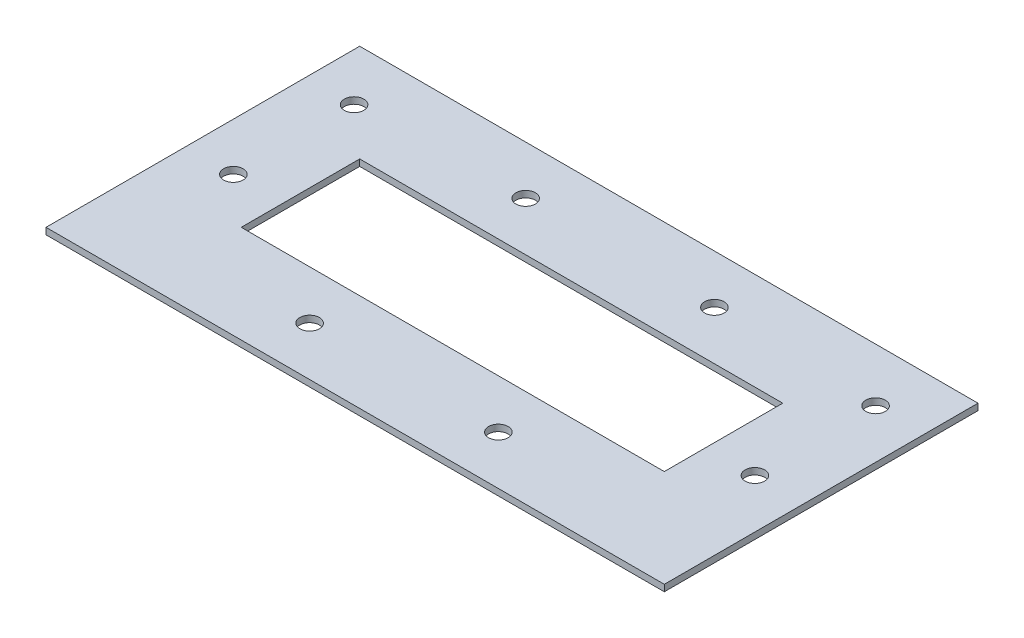
from build123d import *

# Parameters (mm, degrees)
SKETCH2_W           = 94.999999992
SKETCH2_H           = 48.197360298
SKETCH2_R           = 1.5
SKETCH2_W_2         = 64.999999992
SKETCH2_H_2         = 18.197360298
BOSS_EXTRUDE2_DEPTH = 1


with BuildPart() as part:
    # Sketch2 → Boss-Extrude2 (new body)
    with BuildSketch(Plane(origin=(0, 0, 0), x_dir=(1, 0, 0), z_dir=(0, 1, 0))):
        Rectangle(SKETCH2_W, SKETCH2_H)
        with Locations(Location((-14.499999996, 16.598680149, 0), (0, 0, 270))):
            Circle(SKETCH2_R, mode=Mode.SUBTRACT)
        with Locations(Location((14.499999996, 16.598680149, 0), (0, 0, 270))):
            Circle(SKETCH2_R, mode=Mode.SUBTRACT)
        with Locations(Location((-40.148974228, 15.881761887, 0), (0, 0, 270))):
            Circle(SKETCH2_R, mode=Mode.SUBTRACT)
        with Locations(Location((-40.148974228, -2.662696697, 0), (0, 0, 270))):
            Circle(SKETCH2_R, mode=Mode.SUBTRACT)
        with Locations(Location((39.978852734, 15.881761887, 0), (0, 0, 270))):
            Circle(SKETCH2_R, mode=Mode.SUBTRACT)
        with Locations(Location((39.978852734, -2.662696697, 0), (0, 0, 270))):
            Circle(SKETCH2_R, mode=Mode.SUBTRACT)
        with Locations(Location((-14.499999996, -16.598680149, 0), (0, 0, 270))):
            Circle(SKETCH2_R, mode=Mode.SUBTRACT)
        with Locations(Location((14.499999996, -16.598680149, 0), (0, 0, 270))):
            Circle(SKETCH2_R, mode=Mode.SUBTRACT)
        Rectangle(SKETCH2_W_2, SKETCH2_H_2, mode=Mode.SUBTRACT)
    extrude(amount=BOSS_EXTRUDE2_DEPTH)


solid = part.part
